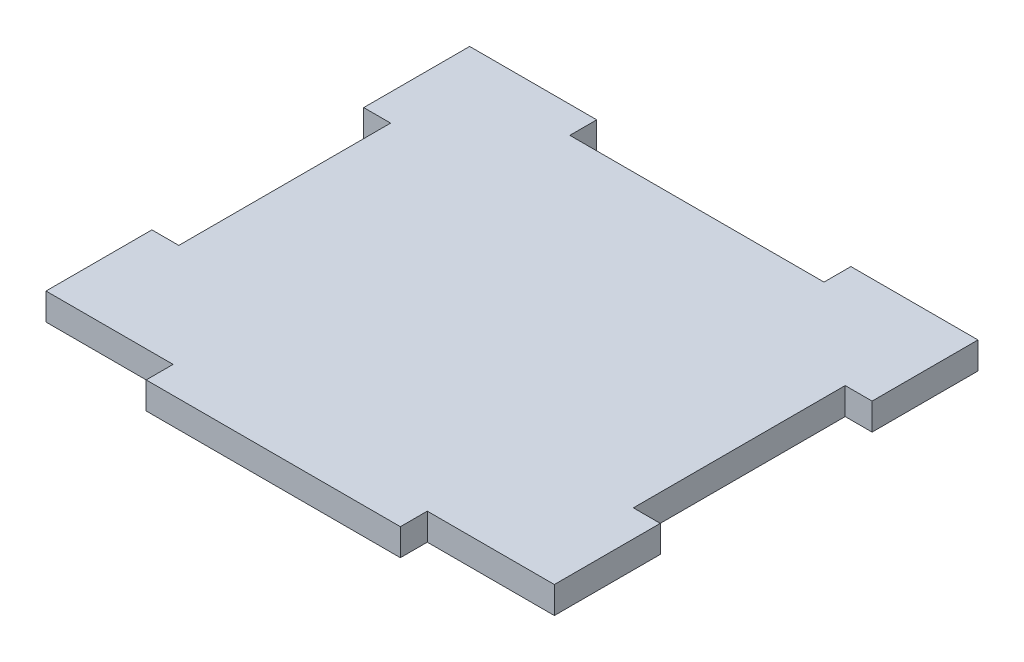
from build123d import *

# Parameters (mm, degrees)
SKETCH1_W           = 60
SKETCH1_H           = 50
BOSS_EXTRUDE1_DEPTH = 3.175
SKETCH2_W           = 30
SKETCH2_H           = 3.175
CUT_EXTRUDE1_DEPTH  = 40.180104964
SKETCH3_W           = 30
SKETCH3_H           = 3.175
BOSS_EXTRUDE2_DEPTH = 3.175
SKETCH5_W           = 3.175
SKETCH5_H           = 25
CUT_EXTRUDE2_DEPTH  = 3.175


with BuildPart() as part:
    # Sketch1 → Boss-Extrude1 (new body)
    with BuildSketch(Plane(origin=(0, 0, 0), x_dir=(1, 0, 0), z_dir=(0, 1, 0))):
        Rectangle(SKETCH1_W, SKETCH1_H)
    extrude(amount=BOSS_EXTRUDE1_DEPTH)

    # Sketch2 → Cut-Extrude1 (cut, through all)
    with BuildSketch(Plane(origin=(0, 3.175, 0), x_dir=(1, 0, 0), z_dir=(0, 1, 0))):
        with Locations((0, 23.4125)):
            Rectangle(SKETCH2_W, SKETCH2_H)
    extrude(amount=-CUT_EXTRUDE1_DEPTH, mode=Mode.SUBTRACT)

    # Sketch3 → Boss-Extrude2 (add)
    with BuildSketch(Plane(origin=(0, 3.175, 0), x_dir=(1, 0, 0), z_dir=(0, 1, 0))):
        with Locations((0, -26.5875)):
            Rectangle(SKETCH3_W, SKETCH3_H)
    extrude(amount=-BOSS_EXTRUDE2_DEPTH)

    # Sketch5 → Cut-Extrude2 (cut)
    with BuildSketch(Plane(origin=(0, 3.175, 0), x_dir=(1, 0, 0), z_dir=(0, 1, 0))):
        with Locations((-28.4125, 0)):
            Rectangle(SKETCH5_W, SKETCH5_H)
        with Locations((28.4125, 0)):
            Rectangle(SKETCH5_W, SKETCH5_H)
    extrude(amount=-CUT_EXTRUDE2_DEPTH, mode=Mode.SUBTRACT)


solid = part.part
